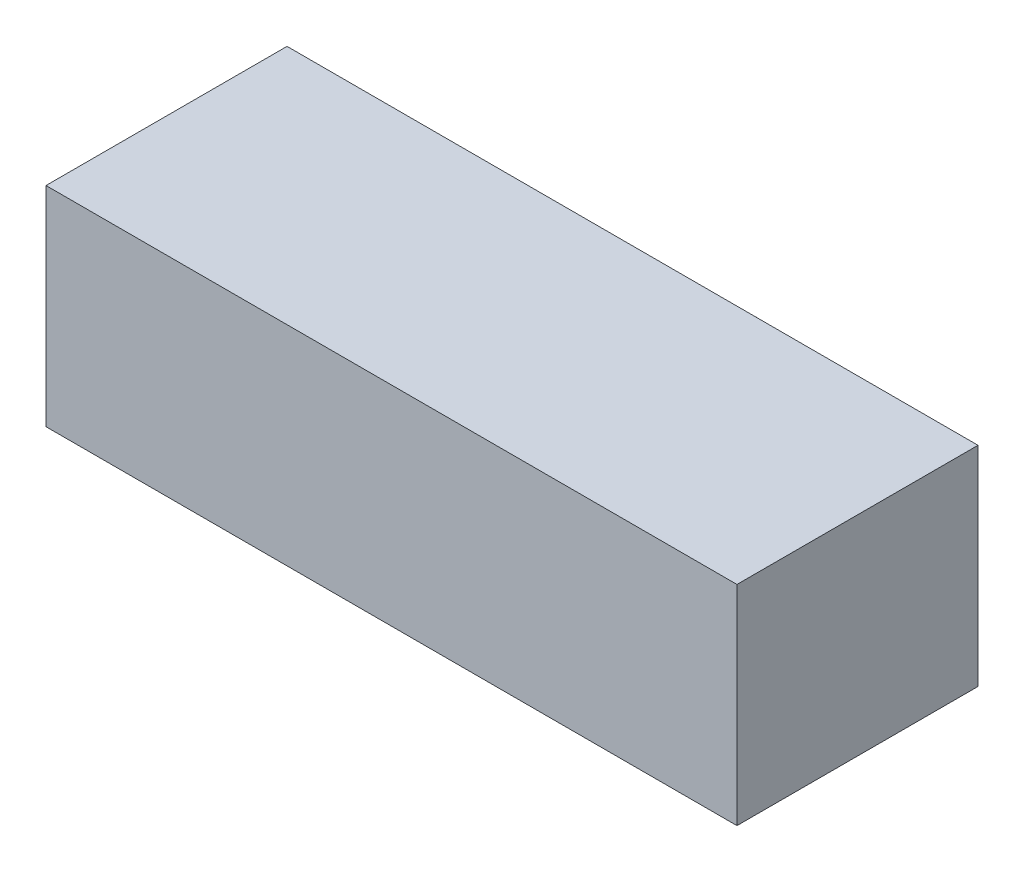
from build123d import *

# Parameters (mm, degrees)
SKETCH_1_W      = 430
SKETCH_1_H      = 150
EXTRUDE_1_DEPTH = 65


with BuildPart() as part:
    # 草图1 → 凸台-拉伸1 (new, symmetric)
    with BuildSketch(Plane(origin=(0, 0, 0), x_dir=(1, 0, 0), z_dir=(0, 1, 0))):
        Rectangle(SKETCH_1_W, SKETCH_1_H)
    extrude(amount=EXTRUDE_1_DEPTH, both=True)


solid = part.part
